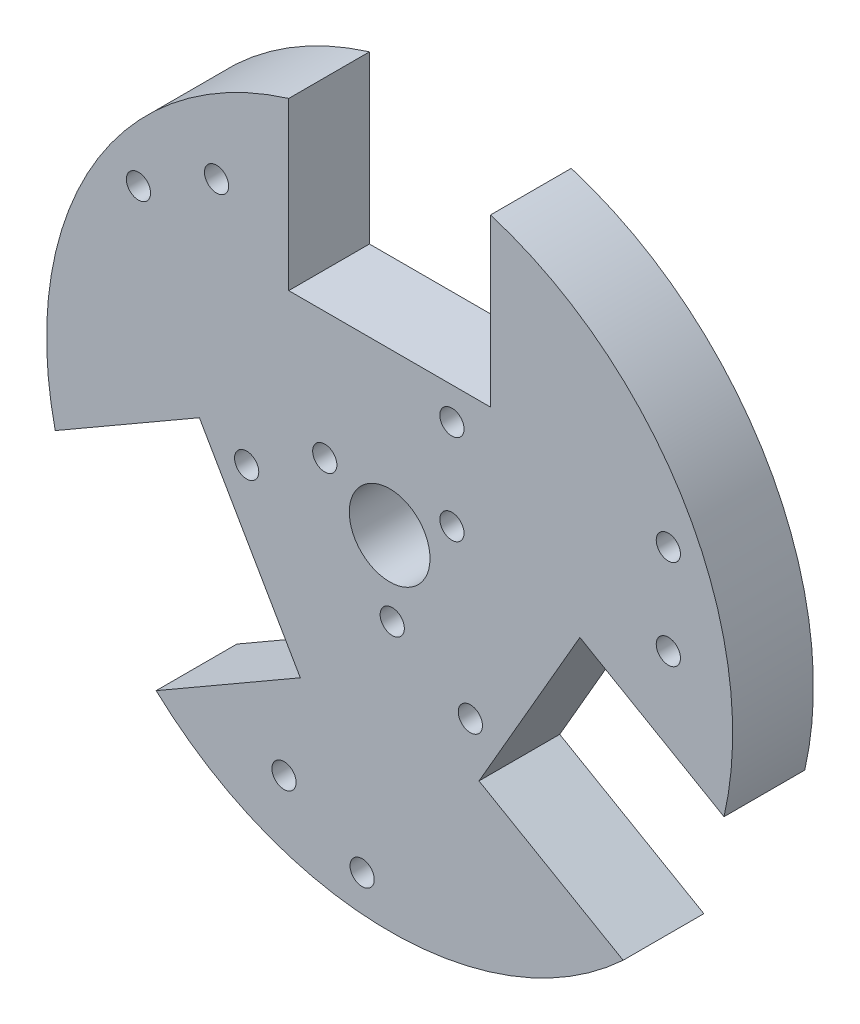
from build123d import *

# Parameters (mm, degrees)
SKETCH4_R      = 42.5
BASE_DEPTH     = 10
SKETCH5_R      = 5
SKETCH5_W      = 25
SKETCH5_H      = 40
TYRE_CUT_DEPTH = 10
SKETCH6_R      = 1.5
NUTS_DEPTH     = 10


with BuildPart() as part:
    # Sketch4 → base (new body)
    with BuildSketch(Plane.XY):
        Circle(SKETCH4_R)
    extrude(amount=BASE_DEPTH)

    # Sketch5 → Tyre cut (cut)
    with BuildSketch(Plane.XY):
        Circle(SKETCH5_R)
        with Locations((0, 40)):
            Rectangle(SKETCH5_W, SKETCH5_H)
        Polygon((11.070508076, -20.825317547), (23.570508076, 0.825317547), (58.211524227, -19.174682453), (45.711524227, -40.825317547), align=None)
        Polygon((-23.570508076, 0.825317547), (-11.070508076, -20.825317547), (-45.711524227, -40.825317547), (-58.211524227, -19.174682453), align=None)
    extrude(amount=TYRE_CUT_DEPTH, mode=Mode.SUBTRACT)

    # Sketch6 → NUTs (cut)
    with BuildSketch(Plane.XY):
        with Locations((7.71570735, 16)):
            Circle(SKETCH6_R)
        with Locations((7.71570735, 4.825317547)):
            Circle(SKETCH6_R)
        with Locations(Location((34.527154016, 4.825317547, 0), (0, 0, 180))):
            Circle(SKETCH6_R)
        with Locations(Location((34.527154016, 16, 0), (0, 0, 180))):
            Circle(SKETCH6_R)
        with Locations((9.998552785, -14.681998573)):
            Circle(SKETCH6_R)
        with Locations((0.320993902, -9.094657347)):
            Circle(SKETCH6_R)
        with Locations(Location((-13.084729431, -32.314051272, 0), (0, 0, 180))):
            Circle(SKETCH6_R)
        with Locations(Location((-3.407170547, -37.901392498, 0), (0, 0, 180))):
            Circle(SKETCH6_R)
        with Locations((-17.714260136, -1.318001427)):
            Circle(SKETCH6_R)
        with Locations((-8.036701252, 4.2693398)):
            Circle(SKETCH6_R)
        with Locations(Location((-21.442424585, 27.488733725, 0), (0, 0, 180))):
            Circle(SKETCH6_R)
        with Locations(Location((-31.119983469, 21.901392498, 0), (0, 0, 180))):
            Circle(SKETCH6_R)
    extrude(amount=NUTS_DEPTH, mode=Mode.SUBTRACT)


solid = part.part
